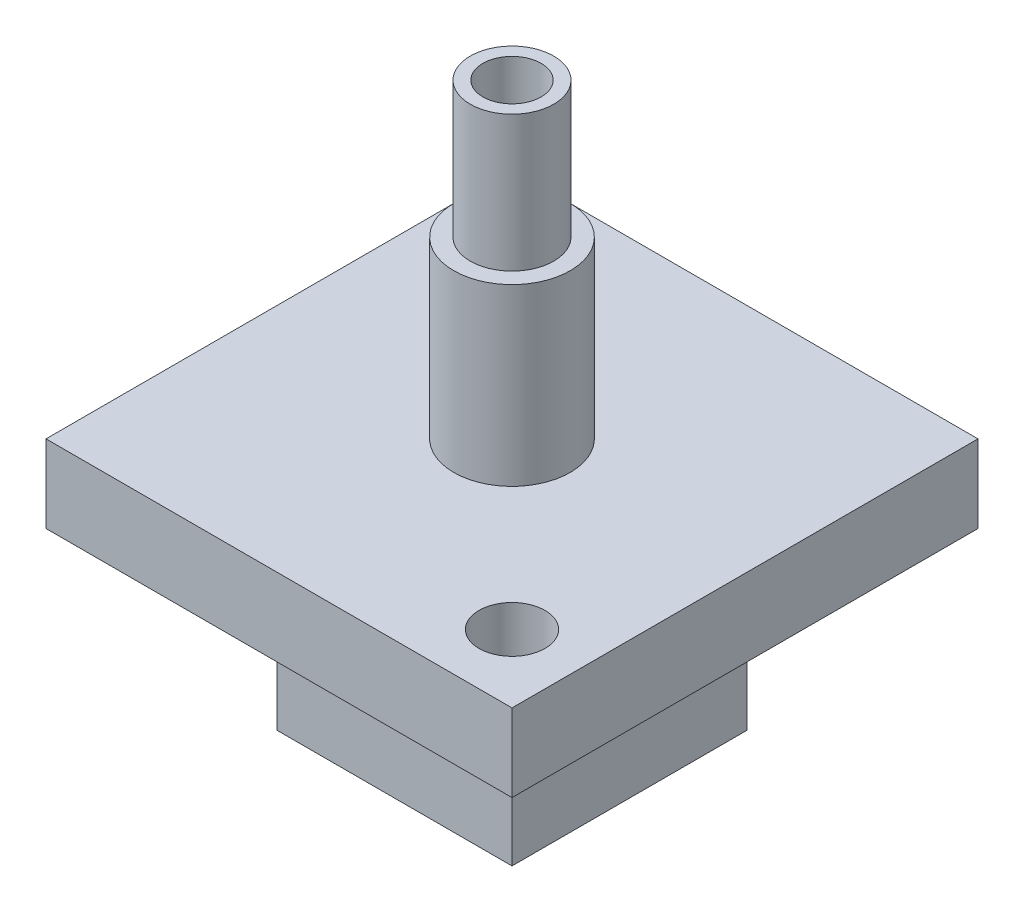
from build123d import *

# Parameters (mm, degrees)
SPIGOT_START          = 105
SKETCH1_W             = 12.1
SKETCH1_H             = 12.1
SPIGOT_DEPTH          = 9
FLANGE_START          = 114
SKETCH2_W             = 24
SKETCH2_H             = 24
FLANGE_DEPTH          = 4
OUTLET_BARB_START     = 118
SKETCH3_R             = 3
OUTLET_BARB_DEPTH     = 9
OUTLET_BARB_TIP_START = 127
SKETCH4_R             = 2.15
OUTLET_BARB_TIP_DEPTH = 7
OUTLET_BORE_START     = 134
SKETCH5_R             = 1.5
OUTLET_BORE_DEPTH     = 29.2
SCREW_HOLES_M3_START  = 113.8
SKETCH6_R             = 1.7
SCREW_HOLES_M3_DEPTH  = 4.4


with BuildPart() as part:
    # Sketch1 → Spigot (new body)
    with BuildSketch(Plane(origin=(0, 0, 0), x_dir=(1, 0, 0), z_dir=(0, 1, 0)).offset(SPIGOT_START)):
        with Locations((14, 0)):
            Rectangle(SKETCH1_W, SKETCH1_H)
    extrude(amount=SPIGOT_DEPTH)

    # Sketch2 → Flange (add)
    with BuildSketch(Plane(origin=(0, 0, 0), x_dir=(1, 0, 0), z_dir=(0, 1, 0)).offset(FLANGE_START)):
        with Locations((14, 0)):
            Rectangle(SKETCH2_W, SKETCH2_H)
    extrude(amount=FLANGE_DEPTH)

    # Sketch3 → Outlet_Barb (add)
    with BuildSketch(Plane(origin=(0, 0, 0), x_dir=(1, 0, 0), z_dir=(0, 1, 0)).offset(OUTLET_BARB_START)):
        with Locations(Location((14, 0, 0), (0, 0, 270))):
            Circle(SKETCH3_R)
    extrude(amount=OUTLET_BARB_DEPTH)

    # Sketch4 → Outlet_Barb_Tip (add)
    with BuildSketch(Plane(origin=(0, 0, 0), x_dir=(1, 0, 0), z_dir=(0, 1, 0)).offset(OUTLET_BARB_TIP_START)):
        with Locations(Location((14, 0, 0), (0, 0, 270))):
            Circle(SKETCH4_R)
    extrude(amount=OUTLET_BARB_TIP_DEPTH)

    # Sketch5 → Outlet_Bore (cut)
    with BuildSketch(Plane(origin=(0, 0, 0), x_dir=(1, 0, 0), z_dir=(0, 1, 0)).offset(OUTLET_BORE_START)):
        with Locations(Location((14, 0, 0), (0, 0, 270))):
            Circle(SKETCH5_R)
    extrude(amount=-OUTLET_BORE_DEPTH, mode=Mode.SUBTRACT)

    # Sketch6 → Screw_Holes_M3 (cut)
    with BuildSketch(Plane(origin=(0, 0, 0), x_dir=(1, 0, 0), z_dir=(0, 1, 0)).offset(SCREW_HOLES_M3_START)):
        with Locations(Location((5.5, 8.5, 0), (0, 0, 270))):
            Circle(SKETCH6_R)
        with Locations(Location((22.5, -8.5, 0), (0, 0, 270))):
            Circle(SKETCH6_R)
    extrude(amount=SCREW_HOLES_M3_DEPTH, mode=Mode.SUBTRACT)


solid = part.part
